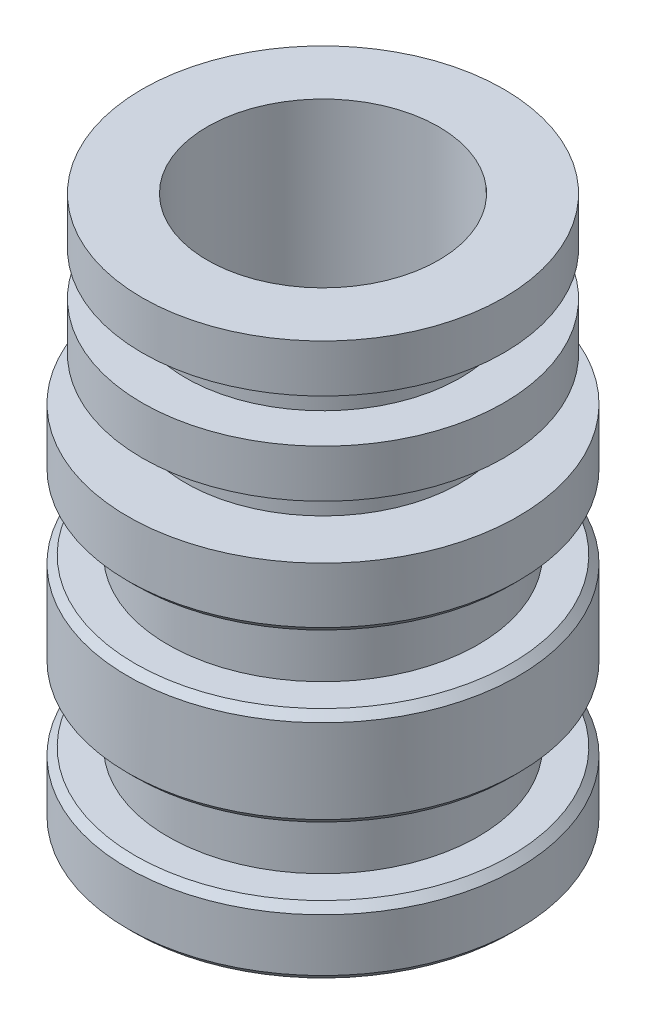
from build123d import *

# Parameters (mm, degrees)
ESQUISSE4_R             = 3
ENL_V_MAT_EXTRU_3_DEPTH = 43.347845282
CHANFREIN4_SIZE         = 1
CHANFREIN3_SIZE         = 0.5


with BuildPart() as part:
    # Esquisse1 → Révolution1 (revolve)
    with BuildSketch(Plane.XY, mode=Mode.PRIVATE) as r_volution1_sk:
        Polygon((0, 0), (-13.5, 0), (-13.5, 4.64), (-10.73, 4.64), (-10.73, 9.34), (-13.5, 9.34), (-13.5, 16.14), (-10.73, 16.14), (-10.73, 20.84), (-13.5, 20.84), (-13.5, 25.2), (-12.5, 25.2), (-9.5, 25.2), (-9.5, 28.2), (-12.5, 28.2), (-12.5, 31.5), (-9.5, 31.5), (-9.5, 34.5), (-12.5, 34.5), (-12.5, 37.8), (-8, 37.8), (-8, 20.84), (-8, 8), (0, 8), align=None)
    revolve(r_volution1_sk.sketch.rotate(Axis((0, -29.115408637, 0), (0, 1, 0)), 270), axis=Axis((0, -29.115408637, 0), (0, 1, 0)))

    # Esquisse4 → Enlèv. mat.-Extru.3 (cut, through all)
    with BuildSketch(Plane.XZ):
        with Locations(Location((0, 0, 0), (0, 0, 270))):
            Circle(ESQUISSE4_R)
    extrude(amount=-ENL_V_MAT_EXTRU_3_DEPTH, mode=Mode.SUBTRACT)

    # Chanfrein4
    chanfrein4_edges = [part.edges().sort_by_distance(p)[0] for p in [
        (0, 8, 3),
        (0, 0, 3),
    ]]
    chamfer(chanfrein4_edges, length=CHANFREIN4_SIZE)

    # Chanfrein3
    chanfrein3_edges = [part.edges().sort_by_distance(p)[0] for p in [
        (0, 0, 13.5),
        (0, 4.64, 13.5),
        (0, 9.34, 13.5),
        (0, 16.14, 13.5),
        (0, 20.84, 13.5),
    ]]
    chamfer(chanfrein3_edges, length=CHANFREIN3_SIZE)


solid = part.part
